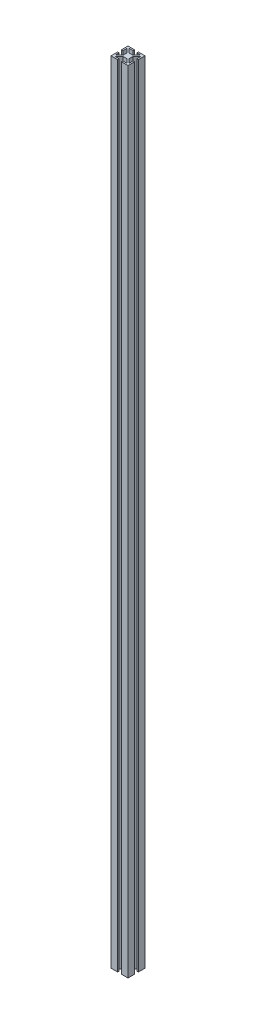
from build123d import *

# Parameters (mm, degrees)
BOSS_EXTRUDE1_DEPTH = 1181.1


with BuildPart() as part:
    # Sketch1 → Boss-Extrude1 (new body)
    with BuildSketch(Plane(origin=(11.365010382, 0, 9.846206226), x_dir=(1, 0, 0), z_dir=(0, 1, 0))):
        Polygon((-24.065010382, 22.546206226), (-14.229795365, 22.546206226), (-14.229795365, 20.336406226), (-20.292645817, 20.336406226), (-14.310945817, 14.354706226), (-8.419074947, 14.354706226), (-2.437374947, 20.336406226), (-8.5002254, 20.336406226), (-8.5002254, 22.546206226), (1.334989618, 22.546206226), (1.334989618, 12.710991208), (-0.874810382, 12.710991208), (-0.874810382, 18.773841661), (-6.856510382, 12.792141661), (-6.856510382, 6.900270791), (-0.874810382, 0.918570791), (-0.874810382, 6.981421243), (1.334989618, 6.981421243), (1.334989618, -2.853793774), (-8.5002254, -2.853793774), (-8.5002254, -0.643993774), (-2.437374947, -0.643993774), (-8.419074947, 5.337706226), (-14.310945817, 5.337706226), (-20.292645817, -0.643993774), (-14.229795365, -0.643993774), (-14.229795365, -2.853793774), (-24.065010382, -2.853793774), (-24.065010382, 6.981421243), (-21.855210382, 6.981421243), (-21.855210382, 0.918570791), (-15.873510382, 6.900270791), (-15.873510382, 12.792141661), (-21.855210382, 18.773841661), (-21.855210382, 12.710991208), (-24.065010382, 12.710991208), align=None)
    extrude(amount=BOSS_EXTRUDE1_DEPTH)


solid = part.part
